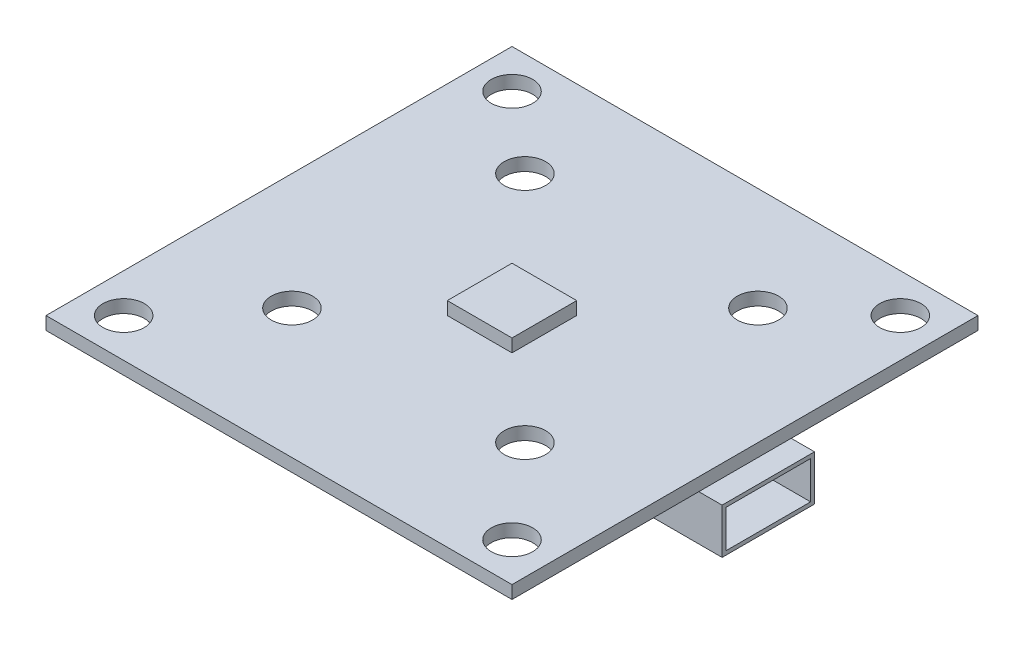
from build123d import *

# Parameters (mm, degrees)
SKETCH1_W      = 36
SKETCH1_H      = 36
EXTRUDE1_DEPTH = 1
SKETCH2_R      = 1.6
EXTRUDE2_DEPTH = 26.475478406
SKETCH5_W      = 5
SKETCH5_H      = 5
EXTRUDE5_DEPTH = 1
SKETCH10_W     = 7.963574277
SKETCH10_H     = 7.13754315
EXTRUDE7_DEPTH = 3.5
SHELL1_T       = -0.3


with BuildPart() as part:
    # Sketch1 → Extrude1 (new body)
    with BuildSketch(Plane(origin=(0, 0, 0), x_dir=(1, 0, 0), z_dir=(0, 1, 0))):
        Rectangle(SKETCH1_W, SKETCH1_H)
    extrude(amount=EXTRUDE1_DEPTH)

    # Sketch2 → Extrude2 (cut, through all)
    with BuildSketch(Plane(origin=(0, 1, 0), x_dir=(1, 0, 0), z_dir=(0, 1, 0))):
        with Locations(Location((-15, 15, 0), (0, 0, 270))):
            Circle(SKETCH2_R)
        with Locations(Location((15, 15, 0), (0, 0, 90))):
            Circle(SKETCH2_R)
        with Locations(Location((15, -15, 0), (0, 0, 270))):
            Circle(SKETCH2_R)
        with Locations(Location((-15, -15, 0), (0, 0, 90))):
            Circle(SKETCH2_R)
        with Locations(Location((-9, 10, 0), (0, 0, 270))):
            Circle(SKETCH2_R)
        with Locations(Location((9, 10, 0), (0, 0, 90))):
            Circle(SKETCH2_R)
        with Locations(Location((9, -8, 0), (0, 0, 270))):
            Circle(SKETCH2_R)
        with Locations(Location((-9, -8, 0), (0, 0, 90))):
            Circle(SKETCH2_R)
    extrude(amount=-EXTRUDE2_DEPTH, mode=Mode.SUBTRACT)


with BuildPart() as body_2:
    # Sketch5 → Extrude5 (new body)
    with BuildSketch(Plane(origin=(0, 1, 0), x_dir=(1, 0, 0), z_dir=(0, 1, 0))):
        Rectangle(SKETCH5_W, SKETCH5_H)
    extrude(amount=EXTRUDE5_DEPTH)


with BuildPart() as body_3:
    # Sketch10 → Extrude7 (new body)
    with BuildSketch(Plane.XZ):
        with Locations((15.818212862, 0)):
            Rectangle(SKETCH10_W, SKETCH10_H)
    extrude(amount=EXTRUDE7_DEPTH)

    # Shell1
    shell1_openings = [body_3.faces().sort_by_distance(p)[0] for p in [
        (19.8, -1.75, 0),
    ]]
    offset(amount=SHELL1_T, openings=shell1_openings, kind=Kind.INTERSECTION)


solid = Compound([part.part, body_2.part, body_3.part])
